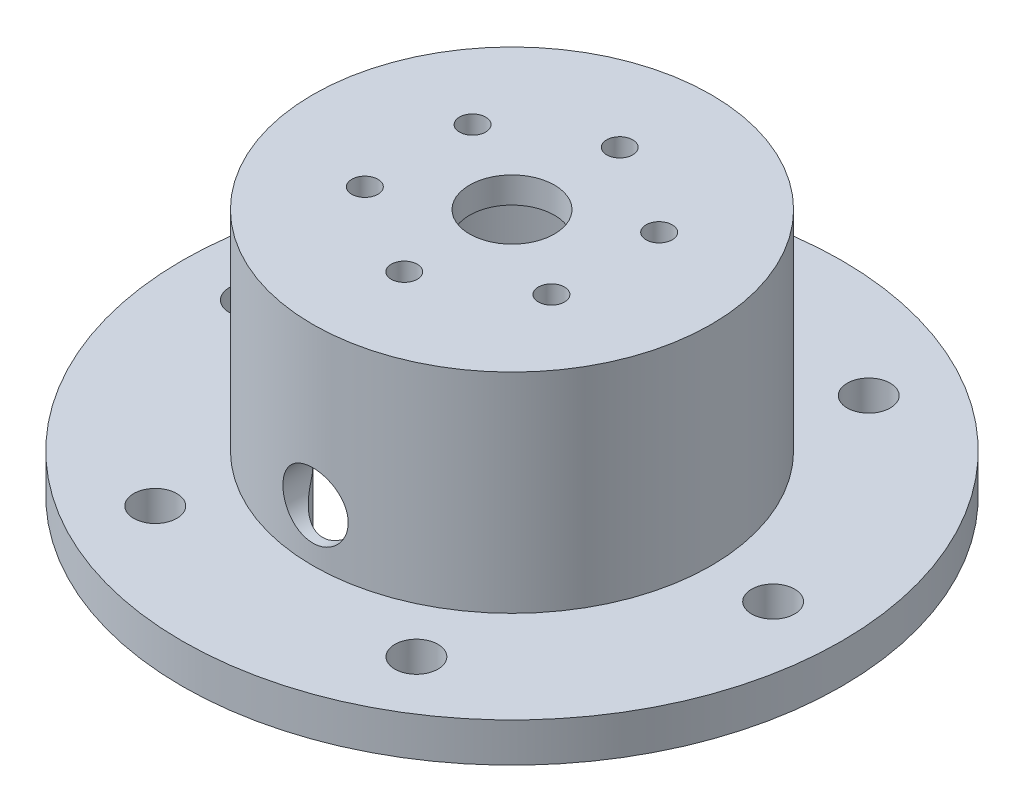
from build123d import *

# Parameters (mm, degrees)
SKETCH2_R          = 1
SKETCH2_R_2        = 1.65
CUT_EXTRUDE1_DEPTH = 41.449042016
CIRPATTERN1_COUNT  = 6
SKETCH3_R          = 2.5
CUT_EXTRUDE2_DEPTH = 38.220626002
CUT_EXTRUDE3_START = -10
CUT_EXTRUDE3_DEPTH = 10


with BuildPart() as part:
    # Sketch1 → Revolve1 (revolve)
    with BuildSketch(Plane.XY, mode=Mode.PRIVATE) as revolve1_sk:
        Polygon((3.25, 8.5), (3.25, 10.5), (15.25, 10.5), (15.25, -5.5), (25.25, -5.5), (25.25, -8.5), (13, -8.5), (13, 8.5), align=None)
    revolve(revolve1_sk.sketch.rotate(Axis((0, -8.78125, 0), (0, 1, 0)), 90), axis=Axis((0, -8.78125, 0), (0, 1, 0)))

    # Sketch2 → Cut-Extrude1 (cut, through all)
    with BuildSketch(Plane(origin=(0, 10.5, 0), x_dir=(1, 0, 0), z_dir=(0, 1, 0))):
        with Locations(Location((0, 8.25, 0), (0, 0, 270))):
            Circle(SKETCH2_R)
        with Locations(Location((20, 0, 0), (0, 0, 270))):
            Circle(SKETCH2_R_2)
    cut_extrude1 = extrude(amount=-CUT_EXTRUDE1_DEPTH, mode=Mode.SUBTRACT)

    # CirPattern1: Cut-Extrude1 ×6 about axis
    cirpattern1_axis = Axis((0, 0, 0), (0, 1, 0))
    for i in range(1, CIRPATTERN1_COUNT):
        add(cut_extrude1.rotate(cirpattern1_axis, i * 360 / CIRPATTERN1_COUNT), mode=Mode.SUBTRACT)

    # Sketch3 → Cut-Extrude2 (cut, through all)
    with BuildSketch(Plane.XY):
        with Locations(Location((0, -1.5, 0), (0, 0, 180))):
            Circle(SKETCH3_R)
    extrude(amount=CUT_EXTRUDE2_DEPTH, mode=Mode.SUBTRACT)

    # Sketch4 → Cut-Extrude3 (cut)
    with BuildSketch(Plane.XZ.offset(8.5).offset(CUT_EXTRUDE3_START)):
        with BuildLine():
            ThreePointArc((2.5, 12.757350822), (0, 13), (-2.5, 12.757350822))
            ThreePointArc((-2.5, 12.757350822), (0, 14.5), (2.5, 12.757350822))
        make_face()
    extrude(amount=CUT_EXTRUDE3_DEPTH, mode=Mode.SUBTRACT)


solid = part.part
